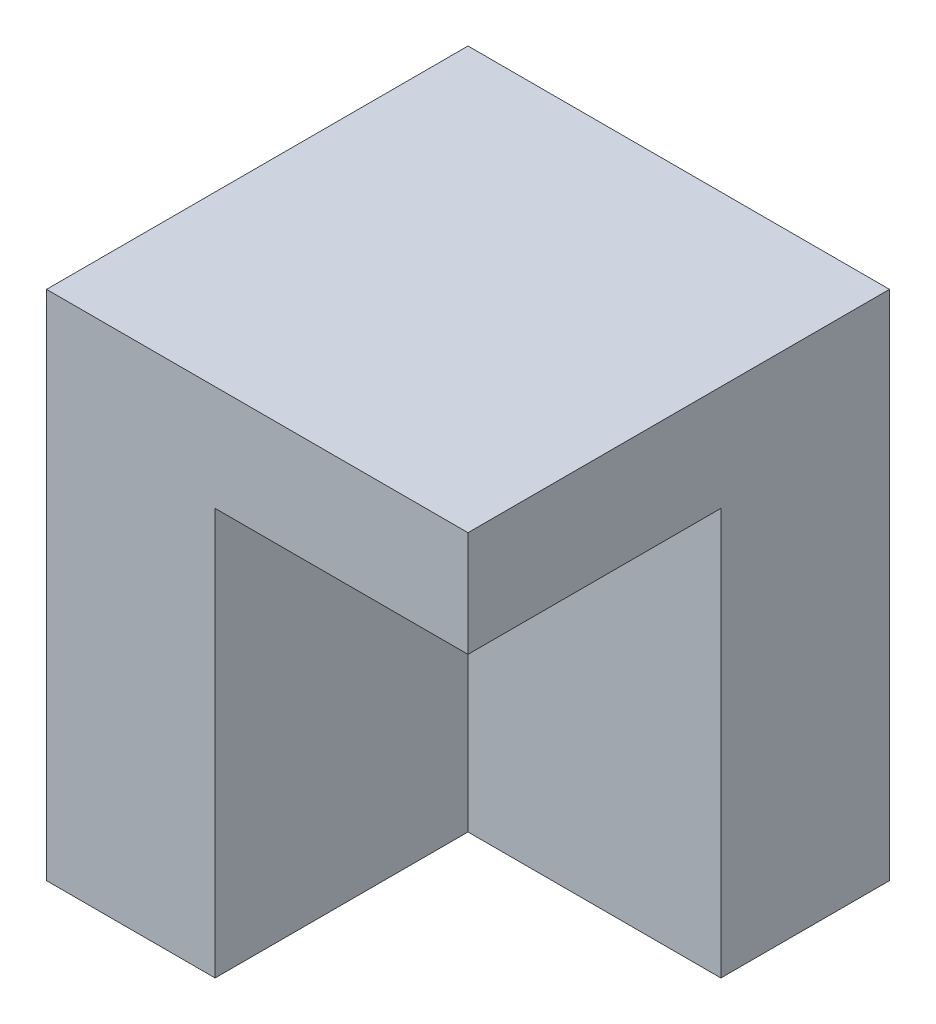
from build123d import *

# Parameters (mm, degrees)
SKETCH1_R           = 1.4
BOSS_EXTRUDE1_DEPTH = 9.65
SKETCH2_W           = 10
SKETCH2_H           = 10
BOSS_EXTRUDE2_DEPTH = 2.5


with BuildPart() as part:
    # Sketch1 → Boss-Extrude1 (new body)
    with BuildSketch(Plane(origin=(0, 0, 0), x_dir=(1, 0, 0), z_dir=(0, 1, 0))):
        Polygon((0, 0), (10, 0), (10, -4), (4, -4), (4, -10), (0, -10), align=None)
        with Locations(Location((2.302943725, -2.302943725, 0), (0, 0, 270))):
            Circle(SKETCH1_R, mode=Mode.SUBTRACT)
    extrude(amount=BOSS_EXTRUDE1_DEPTH)

    # Sketch2 → Boss-Extrude2 (add)
    with BuildSketch(Plane(origin=(0, 9.65, 0), x_dir=(1, 0, 0), z_dir=(0, 1, 0))):
        with Locations((5, -5)):
            Rectangle(SKETCH2_W, SKETCH2_H)
    extrude(amount=BOSS_EXTRUDE2_DEPTH)


solid = part.part
